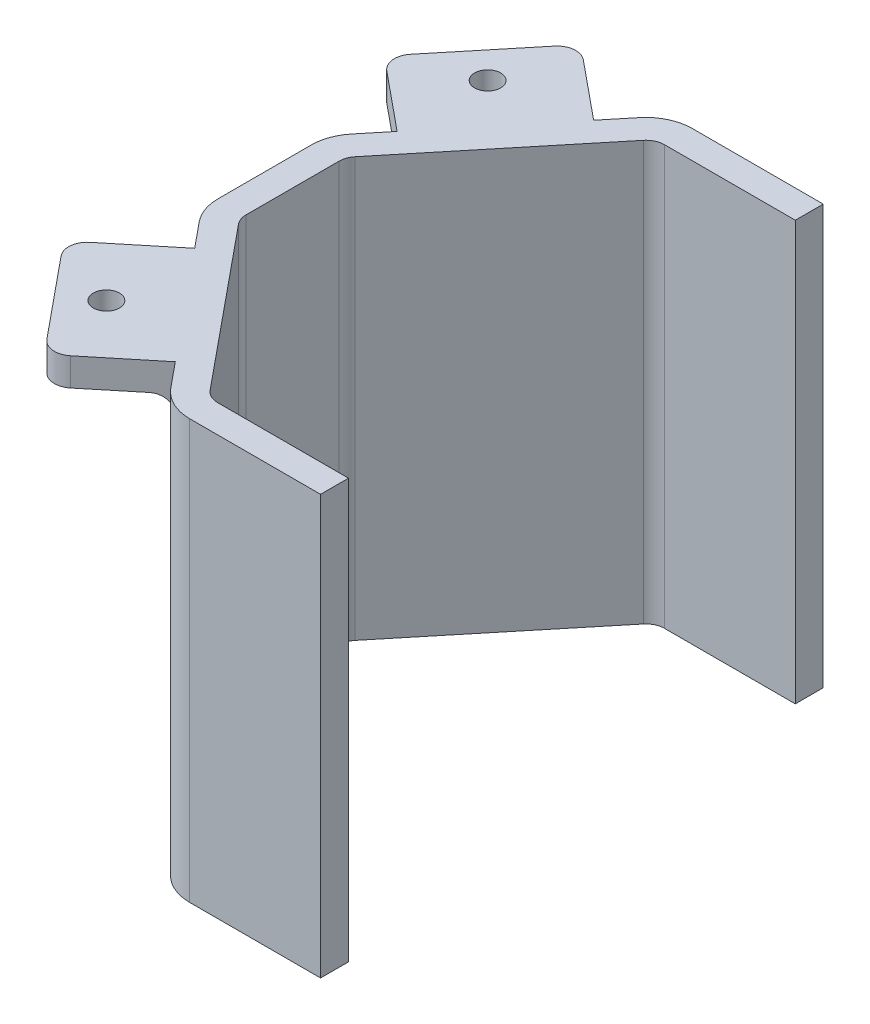
from build123d import *

# Parameters (mm, degrees)
BOSS_EXTRUDE1_DEPTH = 45
BOSS_EXTRUDE2_DEPTH = 3
FILLET1_R           = 2
SKETCH5_R           = 1.4
CUT_EXTRUDE1_DEPTH  = 68.3348504


with BuildPart() as part:
    # Sketch3 → Boss-Extrude1 (new body)
    with BuildSketch(Plane(origin=(0, 0, 0), x_dir=(1, 0, 0), z_dir=(0, 1, 0))):
        with BuildLine():
            Line((-8, 24), (-22.053839059, 24))
            ThreePointArc((-22.053839059, 24), (-22.90912017, 23.807897735), (-23.600099843, 23.268494221))
            Line((-23.600099843, 23.268494221), (-37.546260784, 6.268494221))
            ThreePointArc((-37.546260784, 6.268494221), (-37.883151822, 5.673601675), (-38, 5))
            Line((-38, 5), (-38, -5))
            ThreePointArc((-38, -5), (-37.883151822, -5.673601675), (-37.546260784, -6.268494221))
            Line((-37.546260784, -6.268494221), (-23.600099843, -23.268494221))
            ThreePointArc((-23.600099843, -23.268494221), (-22.90912017, -23.807897735), (-22.053839059, -24))
            Line((-22.053839059, -24), (-8, -24))
            Line((-8, -24), (-8, -27))
            Line((-8, -27), (-22.053839059, -27))
            ThreePointArc((-22.053839059, -27), (-24.192041837, -26.519744338), (-25.919491019, -25.171235552))
            Line((-25.919491019, -25.171235552), (-39.86565196, -8.171235552))
            ThreePointArc((-39.86565196, -8.171235552), (-40.707879555, -6.684004186), (-41, -5))
            Line((-41, -5), (-41, 5))
            ThreePointArc((-41, 5), (-40.707879555, 6.684004186), (-39.86565196, 8.171235552))
            Line((-39.86565196, 8.171235552), (-25.919491019, 25.171235552))
            ThreePointArc((-25.919491019, 25.171235552), (-24.192041837, 26.519744338), (-22.053839059, 27))
            Line((-22.053839059, 27), (-8, 27))
            Line((-8, 27), (-8, 24))
        make_face()
    extrude(amount=BOSS_EXTRUDE1_DEPTH)

    # Sketch4 → Boss-Extrude2 (add)
    with BuildSketch(Plane.XZ.offset(-45)):
        Polygon((-28.135718162, 22.469713492), (-35.867022082, 28.812184595), (-45.380728737, 17.215228715), (-37.649424817, 10.872757612), align=None)
        Polygon((-37.649424817, -10.872757612), (-45.380728737, -17.215228715), (-35.867022082, -28.812184595), (-28.135718162, -22.469713492), align=None)
    extrude(amount=BOSS_EXTRUDE2_DEPTH)

    # Fillet1
    fillet1_edges = [part.edges().sort_by_distance(p)[0] for p in [
        (-35.867022082, 43.5, 28.812184595),
        (-45.380728737, 43.5, 17.215228715),
        (-32.892571489, 42, 16.671235552),
        (-45.380728737, 43.5, -17.215228715),
        (-35.867022082, 43.5, -28.812184595),
        (-32.892571489, 42, -16.671235552),
    ]]
    fillet(fillet1_edges, radius=FILLET1_R)

    # Sketch5 → Cut-Extrude1 (cut, through all)
    with BuildSketch(Plane.XZ.offset(-42)):
        with Locations(Location((-37.531353842, 20.476718214, 0), (0, 0, 270))):
            Circle(SKETCH5_R)
    cut_extrude1 = extrude(amount=-CUT_EXTRUDE1_DEPTH, mode=Mode.SUBTRACT)

    # Mirror1: Cut-Extrude1 across plane
    add(cut_extrude1.mirror(Plane.XY), mode=Mode.SUBTRACT)


solid = part.part
